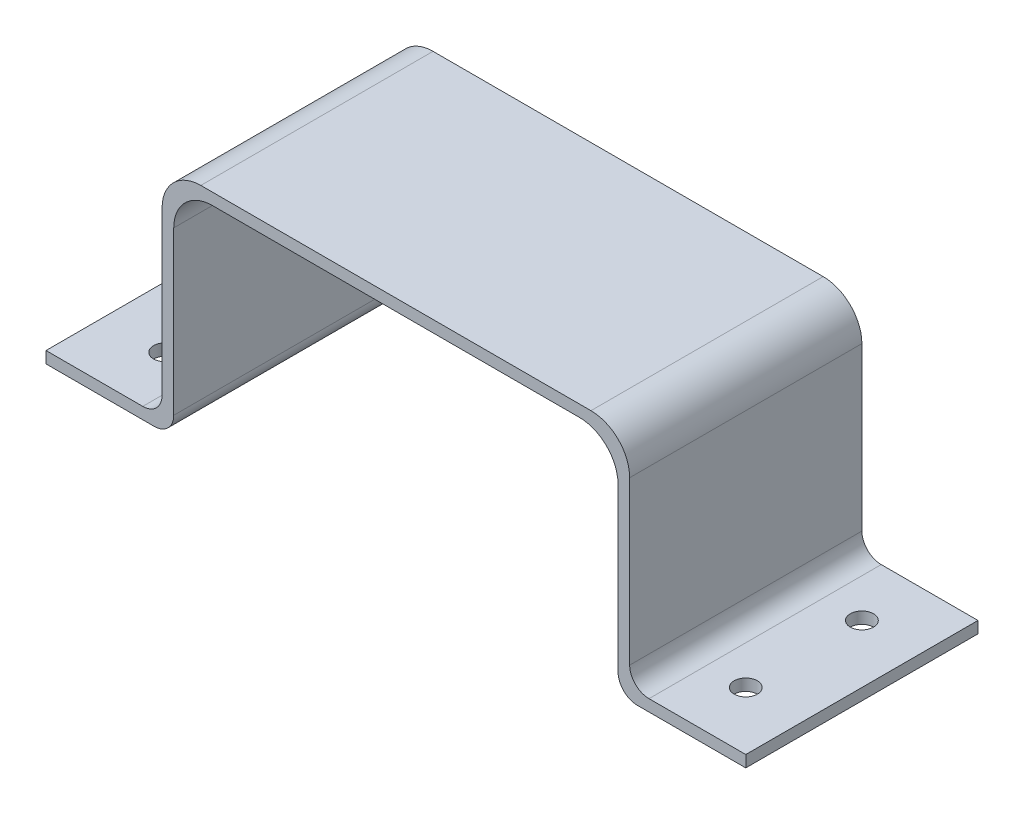
from build123d import *

# Parameters (mm, degrees)
EXTRUDE_THIN1_DEPTH       = 60
SKETCH2_R                 = 3
CUT_EXTRUDE1_DEPTH        = 10
LPATTERN1_COUNT           = 2
LPATTERN1_PITCH           = 30
LPATTERN2_COUNT           = 2
LPATTERN2_PITCH           = 150
LPATTERN2_COPY_1_SKETCH_R = 3
LPATTERN2_COPY_1_DEPTH    = 10
FILLET1_R                 = 10
FILLET2_R                 = 10
FILLET3_R                 = 5
FILLET4_R                 = 5


with BuildPart() as part:
    # Sketch1 → Extrude-Thin1 (new body)
    with BuildSketch(Plane.XY):
        Polygon((30, -56.94), (0, -56.94), (0, 0), (-120.8, 0), (-120.8, -56.94), (-150.8, -56.94), (-150.8, -59.94), (-117.8, -59.94), (-117.8, -3), (-3, -3), (-3, -59.94), (30, -59.94), align=None)
    extrude(amount=EXTRUDE_THIN1_DEPTH)

    # Sketch2 → Cut-Extrude1 (cut)
    with BuildSketch(Plane(origin=(0, -56.94, 0), x_dir=(1, 0, 0), z_dir=(0, 1, 0))):
        with Locations(Location((15, -15, 0), (0, 0, 270))):
            Circle(SKETCH2_R)
    cut_extrude1 = extrude(amount=-CUT_EXTRUDE1_DEPTH, mode=Mode.SUBTRACT)

    # LPattern1: Cut-Extrude1 ×2
    with Locations(*[(0, 0, i * LPATTERN1_PITCH) for i in range(1, LPATTERN1_COUNT)]):
        add(cut_extrude1, mode=Mode.SUBTRACT)

    # LPattern2: Cut-Extrude1 ×2
    with Locations(*[(-i * LPATTERN2_PITCH, 0, 0) for i in range(1, LPATTERN2_COUNT)]):
        add(cut_extrude1, mode=Mode.SUBTRACT)

    # LPattern2 copy 1 sketch → LPattern2 copy 1 (cut)
    with BuildSketch(Plane(origin=(-150, -56.94, 30), x_dir=(1, 0, 0), z_dir=(0, 1, 0))):
        with Locations(Location((15, -15, 0), (0, 0, 270))):
            Circle(LPATTERN2_COPY_1_SKETCH_R)
    extrude(amount=-LPATTERN2_COPY_1_DEPTH, mode=Mode.SUBTRACT)

    # Fillet1
    fillet1_edges = [part.edges().sort_by_distance(p)[0] for p in [
        (-120.8, 0, 30),
        (0, 0, 30),
    ]]
    fillet(fillet1_edges, radius=FILLET1_R)

    # Fillet2
    fillet2_edges = [part.edges().sort_by_distance(p)[0] for p in [
        (-3, -3, 30),
        (-117.8, -3, 30),
    ]]
    fillet(fillet2_edges, radius=FILLET2_R)

    # Fillet3
    fillet3_edges = [part.edges().sort_by_distance(p)[0] for p in [
        (-120.8, -56.94, 30),
        (0, -56.94, 30),
    ]]
    fillet(fillet3_edges, radius=FILLET3_R)

    # Fillet4
    fillet4_edges = [part.edges().sort_by_distance(p)[0] for p in [
        (-3, -59.94, 30),
        (-117.8, -59.94, 30),
    ]]
    fillet(fillet4_edges, radius=FILLET4_R)


solid = part.part
